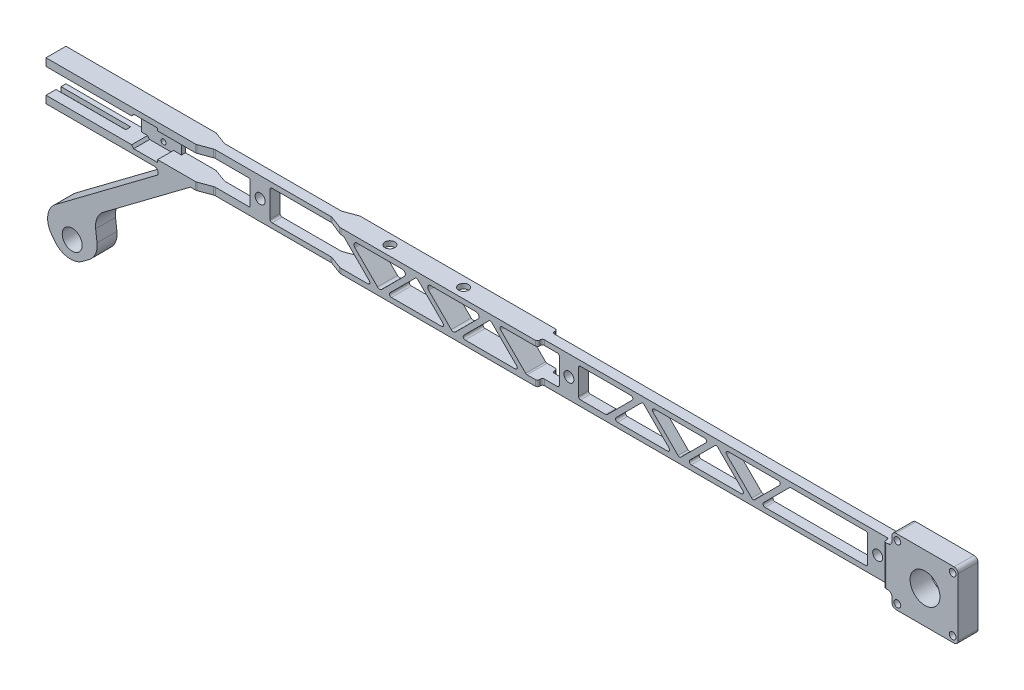
from build123d import *

# Parameters (mm, degrees)
BOSS_EXTRUDE1_DEPTH             = 12.7
CUT_EXTRUDE1_DEPTH              = 12.7
LPATTERN1_COUNT                 = 7
LPATTERN1_PITCH                 = 46.99
CUT_EXTRUDE2_DEPTH              = 12.7
LPATTERN2_COUNT                 = 8
LPATTERN2_PITCH                 = 46.99
CUT_EXTRUDE13_DEPTH             = 12.7
LPATTERN5_COUNT                 = 2
LPATTERN5_PITCH                 = 46.99
CUT_EXTRUDE10_DEPTH             = 12.7
LPATTERN3_COUNT                 = 2
LPATTERN3_PITCH                 = 46.99
SKETCH19_W                      = 3.175
SKETCH19_H                      = 22.225
CUT_EXTRUDE4_DEPTH              = 44.45
SKETCH18_W                      = 50.8
SKETCH18_H                      = 15.875
CUT_EXTRUDE3_DEPTH              = 573.205120564
CUT_EXTRUDE5_DEPTH              = 10.16
SKETCH21_W                      = 50.8
SKETCH21_H                      = 15.875
CUT_EXTRUDE6_DEPTH              = 573.154380915
F_1_8_0_125_DIAMETER_HOLE1_D    = 3.175
CUT_EXTRUDE17_DEPTH             = 12.7
CUT_EXTRUDE12_DEPTH             = 12.7
BOSS_EXTRUDE3_DEPTH             = 12.7
BOSS_EXTRUDE4_DEPTH             = 12.7
CUT_EXTRUDE7_DEPTH              = 12.7
SKETCH30_R                      = 6.35
BOSS_EXTRUDE5_DEPTH             = 12.7
CUT_EXTRUDE8_DEPTH              = 18.796
FILLET1_R                       = 12.7
F_1_4_0_25_DIAMETER_HOLE2_D     = 6.35
F_1_4_0_25_DIAMETER_HOLE3_D     = 6.35
F_1_4_0_25_DIAMETER_HOLE3_DEPTH = 3.175
F_1_4_0_25_DIAMETER_HOLE3_TIP   = 1.907732465
F_1_4_0_25_DIAMETER_HOLE1_D     = 6.35
SKETCH32_R                      = 3.175
BOSS_EXTRUDE6_DEPTH             = 12.7
SKETCH33_R                      = 9.525
SKETCH33_R_2                    = 2.159
CUT_EXTRUDE9_DEPTH              = 12.7
FILLET2_R                       = 2.54
CUT_EXTRUDE16_DEPTH             = 12.7
CUT_EXTRUDE15_REACH             = 592.724
CUT_EXTRUDE18_REACH             = 588.812


with BuildPart() as part:
    # Sketch1 → Boss-Extrude1 (new body)
    with BuildSketch(Plane.XY):
        with BuildLine():
            Line((2.54, 0), (568.96, 0))
            ThreePointArc((568.96, 0), (570.756051224, 0.743948776), (571.5, 2.54))
            Line((571.5, 2.54), (571.5, 22.86))
            ThreePointArc((571.5, 22.86), (570.756051224, 24.656051224), (568.96, 25.4))
            Line((568.96, 25.4), (2.54, 25.4))
            Line((2.54, 25.4), (0, 25.4))
            Line((0, 25.4), (0, 22.86))
            Line((0, 22.86), (0, 2.54))
            Line((0, 2.54), (0, 0))
            Line((0, 0), (2.54, 0))
        make_face()
    extrude(amount=BOSS_EXTRUDE1_DEPTH)

    # Sketch2 → Cut-Extrude1 (cut)
    with BuildSketch(Plane.XY):
        with BuildLine():
            Line((173.246051224, 3.175), (205.213948776, 3.175))
            ThreePointArc((205.213948776, 3.175), (206.387275782, 3.958992041), (206.111974388, 5.343025612))
            Line((206.111974388, 5.343025612), (190.128025612, 21.326974388))
            ThreePointArc((190.128025612, 21.326974388), (189.23, 21.698948776), (188.331974388, 21.326974388))
            Line((188.331974388, 21.326974388), (172.348025612, 5.343025612))
            ThreePointArc((172.348025612, 5.343025612), (172.072724218, 3.958992041), (173.246051224, 3.175))
        make_face()
    cut_extrude1 = extrude(amount=CUT_EXTRUDE1_DEPTH, mode=Mode.SUBTRACT)

    # LPattern1: Cut-Extrude1 ×7, 3 skipped
    with Locations(*[(i * LPATTERN1_PITCH, 0, 0) for i in range(1, LPATTERN1_COUNT) if i not in (1, 2, 3)]):
        add(cut_extrude1, mode=Mode.SUBTRACT)

    # Sketch3 → Cut-Extrude2 (cut)
    with BuildSketch(Plane.XY):
        with BuildLine():
            Line((149.751051224, 22.225), (181.718948776, 22.225))
            ThreePointArc((181.718948776, 22.225), (182.892275782, 21.441007959), (182.616974388, 20.056974388))
            Line((182.616974388, 20.056974388), (166.633025612, 4.073025612))
            ThreePointArc((166.633025612, 4.073025612), (165.735, 3.701051224), (164.836974388, 4.073025612))
            Line((164.836974388, 4.073025612), (148.853025612, 20.056974388))
            ThreePointArc((148.853025612, 20.056974388), (148.577724218, 21.441007959), (149.751051224, 22.225))
        make_face()
    cut_extrude2 = extrude(amount=CUT_EXTRUDE2_DEPTH, mode=Mode.SUBTRACT)

    # LPattern2: Cut-Extrude2 ×8, 2 skipped
    with Locations(*[(i * LPATTERN2_PITCH, 0, 0) for i in range(1, LPATTERN2_COUNT) if i not in (1, 2)]):
        add(cut_extrude2, mode=Mode.SUBTRACT)

    # Sketch37 → Cut-Extrude13 (cut)
    with BuildSketch(Plane.XY.offset(12.7)):
        with BuildLine():
            Line((198.274076836, 22.225), (227.175923164, 22.225))
            ThreePointArc((227.175923164, 22.225), (228.935913673, 21.049011939), (228.522961582, 18.972961582))
            Line((228.522961582, 18.972961582), (214.072038418, 4.522038418))
            ThreePointArc((214.072038418, 4.522038418), (212.725, 3.964076836), (211.377961582, 4.522038418))
            Line((211.377961582, 4.522038418), (196.927038418, 18.972961582))
            ThreePointArc((196.927038418, 18.972961582), (196.514086327, 21.049011939), (198.274076836, 22.225))
        make_face()
    cut_extrude13 = extrude(amount=-CUT_EXTRUDE13_DEPTH, mode=Mode.SUBTRACT)

    # LPattern5: Cut-Extrude13 ×2
    with Locations(*[(i * LPATTERN5_PITCH, 0, 0) for i in range(1, LPATTERN5_COUNT)]):
        add(cut_extrude13, mode=Mode.SUBTRACT)

    # Sketch34 → Cut-Extrude10 (cut)
    with BuildSketch(Plane.XY.offset(12.7)):
        with BuildLine():
            Line((220.236051224, 3.175), (252.203948776, 3.175))
            ThreePointArc((252.203948776, 3.175), (253.377275782, 3.958992041), (253.101974388, 5.343025612))
            Line((253.101974388, 5.343025612), (237.118025612, 21.326974388))
            ThreePointArc((237.118025612, 21.326974388), (236.22, 21.698948776), (235.321974388, 21.326974388))
            Line((235.321974388, 21.326974388), (219.338025612, 5.343025612))
            ThreePointArc((219.338025612, 5.343025612), (219.062724218, 3.958992041), (220.236051224, 3.175))
        make_face()
    cut_extrude10 = extrude(amount=-CUT_EXTRUDE10_DEPTH, mode=Mode.SUBTRACT)

    # LPattern3: Cut-Extrude10 ×2
    with Locations(*[(i * LPATTERN3_PITCH, 0, 0) for i in range(1, LPATTERN3_COUNT)]):
        add(cut_extrude10, mode=Mode.SUBTRACT)

    # Sketch19 → Cut-Extrude4 (cut)
    with BuildSketch(Plane.ZY):
        with Locations((4.7625, 12.7)):
            Rectangle(SKETCH19_W, SKETCH19_H)
    extrude(amount=-CUT_EXTRUDE4_DEPTH, mode=Mode.SUBTRACT)

    # Sketch18 → Cut-Extrude3 (cut, through all)
    with BuildSketch(Plane.XY.offset(12.7)):
        with Locations((25.4, 12.6365)):
            Rectangle(SKETCH18_W, SKETCH18_H)
    extrude(amount=-CUT_EXTRUDE3_DEPTH, mode=Mode.SUBTRACT)

    # Sketch20 → Cut-Extrude5 (cut)
    with BuildSketch(Plane.XY.offset(12.7)):
        Polygon((50.8, 20.574), (54.61, 20.574), (55.88, 22.1615), (71.12, 22.1615), (71.12, 20.574), (127, 20.574), (127, 4.699), (71.12, 4.699), (71.12, 3.1115), (55.88, 3.1115), (54.61, 4.699), (50.8, 4.699), align=None)
    extrude(amount=-CUT_EXTRUDE5_DEPTH, mode=Mode.SUBTRACT)

    # Sketch21 → Cut-Extrude6 (cut, through all)
    with BuildSketch(Plane.XY.offset(2.54)):
        with Locations((101.6, 12.6365)):
            Rectangle(SKETCH21_W, SKETCH21_H)
    extrude(amount=-CUT_EXTRUDE6_DEPTH, mode=Mode.SUBTRACT)

    # 1/8 (0.125) Diameter Hole1 (through all)
    with Locations(Plane.XY.offset(2.54)):
        with Locations((64.77, 18.9865), (64.77, 6.2865)):
            Hole(F_1_8_0_125_DIAMETER_HOLE1_D / 2)

    # Sketch46 → Cut-Extrude17 (cut)
    with BuildSketch(Plane.XY.offset(12.7)):
        with BuildLine():
            Line((173.246051224, 3.175), (140.97, 3.175))
            ThreePointArc((140.97, 3.175), (140.071974388, 3.546974388), (139.7, 4.445))
            Line((139.7, 4.445), (139.7, 20.955))
            ThreePointArc((139.7, 20.955), (140.071974388, 21.853025612), (140.97, 22.225))
            Line((140.97, 22.225), (181.718948776, 22.225))
            Line((181.718948776, 22.225), (189.23, 21.698948776))
            Line((189.23, 21.698948776), (173.246051224, 3.175))
        make_face()
    extrude(amount=-CUT_EXTRUDE17_DEPTH, mode=Mode.SUBTRACT)

    # Sketch36 → Cut-Extrude12 (cut)
    with BuildSketch(Plane.XY.offset(12.7)):
        with BuildLine():
            Line((306.705, 3.701051224), (322.834, 3.701051224))
            ThreePointArc((322.834, 3.701051224), (323.732025612, 4.073025612), (324.104, 4.971051224))
            Line((324.104, 4.971051224), (324.104, 20.955))
            ThreePointArc((324.104, 20.955), (323.732025612, 21.853025612), (322.834, 22.225))
            Line((322.834, 22.225), (322.688948776, 22.225))
            Line((322.688948776, 22.225), (306.705, 3.701051224))
        make_face()
    cut_extrude12 = extrude(amount=-CUT_EXTRUDE12_DEPTH, mode=Mode.SUBTRACT)

    # Mirror1: Cut-Extrude12 across plane
    add(cut_extrude12.mirror(Plane(origin=(330.2, 0, 0), x_dir=(0, 0, 1), z_dir=(1, 0, 0))), mode=Mode.SUBTRACT)

    # Sketch8 → Boss-Extrude3 (add)
    with BuildSketch(Plane.XY):
        Polygon((92.075, 0), (-9.525, -76.2), (-15.24, -68.58), (76.2, 0), align=None)
    extrude(amount=BOSS_EXTRUDE3_DEPTH)

    # Sketch13 → Boss-Extrude4 (add)
    with BuildSketch(Plane.XY):
        with BuildLine():
            Line((69.85, 0), (76.2, 0))
            Line((76.2, 0), (71.12, -3.81))
            ThreePointArc((71.12, -3.81), (71.419048922, -1.593650359), (69.85, 0))
        make_face()
    extrude(amount=BOSS_EXTRUDE4_DEPTH)

    # Sketch29 → Cut-Extrude7 (cut)
    with BuildSketch(Plane.XY.offset(12.7)):
        Polygon((-9.525, -76.2), (1.651, -67.818), (-0.254, -65.278), (-11.43, -73.66), align=None)
    extrude(amount=-CUT_EXTRUDE7_DEPTH, mode=Mode.SUBTRACT)

    # Sketch30 → Boss-Extrude5 (add)
    with BuildSketch(Plane(origin=(0, 0, 0), x_dir=(-1, 0, 0), z_dir=(0, 0, -1))):
        Polygon((-1.651, -67.818), (-13.081, -83.058), (-33.401, -67.818), (-30.769818102, -45.978886423), align=None)
        with Locations((-16.6878, -66.7004)):
            Circle(SKETCH30_R, mode=Mode.SUBTRACT)
    extrude(amount=-BOSS_EXTRUDE5_DEPTH)

    # Sketch31 → Cut-Extrude8 (cut)
    with BuildSketch(Plane(origin=(0, 0, 0), x_dir=(-1, 0, 0), z_dir=(0, 0, -1))):
        Polygon((0.254, -65.278), (4.064, -60.198), (15.24, -68.58), (11.43, -73.66), align=None)
    extrude(amount=-CUT_EXTRUDE8_DEPTH, mode=Mode.SUBTRACT)

    # Fillet1
    fillet1_edges = [part.edges().sort_by_distance(p)[0] for p in [
        (30.769818102, -45.978886423, 6.35),
        (13.081, -83.058, 6.35),
        (33.401, -67.818, 6.35),
        (-4.064, -60.198, 6.35),
    ]]
    fillet(fillet1_edges, radius=FILLET1_R)

    # 1/4 (0.25) Diameter Hole2 (through all)
    with Locations(Plane.XY.offset(12.7)):
        with Locations((133.35, 12.7), (330.2, 12.7), (527.05, 12.7)):
            Hole(F_1_4_0_25_DIAMETER_HOLE2_D / 2)

    # 1/4 (0.25) Diameter Hole3
    with Locations(Plane(origin=(0, 25.4, 0), x_dir=(1, 0, 0), z_dir=(0, 1, 0))):
        with Locations((212.888423164, -6.35), (259.878423164, -6.35)):
            Hole(F_1_4_0_25_DIAMETER_HOLE3_D / 2, depth=F_1_4_0_25_DIAMETER_HOLE3_DEPTH)
            with Locations((0, 0, -(F_1_4_0_25_DIAMETER_HOLE3_DEPTH + F_1_4_0_25_DIAMETER_HOLE3_TIP / 2))):  # 118° drill point
                Cone(0, F_1_4_0_25_DIAMETER_HOLE3_D / 2, F_1_4_0_25_DIAMETER_HOLE3_TIP, mode=Mode.SUBTRACT)

    # 1/4 (0.25) Diameter Hole1 (through all)
    with Locations(Plane.XY.offset(12.7)):
        with Locations((560.3875, 12.7)):
            Hole(F_1_4_0_25_DIAMETER_HOLE1_D / 2)

    # Sketch32 → Boss-Extrude6 (add)
    with BuildSketch(Plane(origin=(0, 0, 0), x_dir=(-1, 0, 0), z_dir=(0, 0, -1))):
        Polygon((-581.4695, 12.7), (-581.4695, 33.782), (-539.3055, 33.782), (-539.3055, 25.4), (-539.3055, 0), (-539.3055, -8.382), (-581.4695, -8.382), align=None)
        with Locations(Location((-560.3875, 12.7, 0), (0, 0, 180))):
            Circle(SKETCH32_R, mode=Mode.SUBTRACT)
    extrude(amount=-BOSS_EXTRUDE6_DEPTH)

    # Sketch33 → Cut-Extrude9 (cut)
    with BuildSketch(Plane.XY.offset(12.7)):
        with Locations((560.3875, 12.7)):
            Circle(SKETCH33_R)
        with Locations((578.005108392, 30.086668164)):
            Circle(SKETCH33_R_2)
        with Locations((578.005108392, -4.686668164)):
            Circle(SKETCH33_R_2)
        with Locations((542.769891608, -4.686668164)):
            Circle(SKETCH33_R_2)
        with Locations((542.769891608, 30.086668164)):
            Circle(SKETCH33_R_2)
    extrude(amount=-CUT_EXTRUDE9_DEPTH, mode=Mode.SUBTRACT)

    # Fillet2
    fillet2_edges = [part.edges().sort_by_distance(p)[0] for p in [
        (539.3055, 25.4, 6.35),
        (539.3055, 33.782, 6.35),
        (581.4695, -8.382, 6.35),
        (581.4695, 33.782, 6.35),
        (539.3055, 0, 6.35),
        (539.3055, -8.382, 6.35),
    ]]
    fillet(fillet2_edges, radius=FILLET2_R)

    # Sketch45 → Cut-Extrude16 (cut)
    with BuildSketch(Plane.XY.offset(12.7)):
        with BuildLine():
            Line((487.153948776, 3.175), (519.43, 3.175))
            ThreePointArc((519.43, 3.175), (520.328025612, 3.546974388), (520.7, 4.445))
            Line((520.7, 4.445), (520.7, 20.955))
            ThreePointArc((520.7, 20.955), (520.328025612, 21.853025612), (519.43, 22.225))
            Line((519.43, 22.225), (510.648948776, 22.225))
            Line((510.648948776, 22.225), (471.696051224, 22.225))
            ThreePointArc((471.696051224, 22.225), (471.210043265, 22.128327006), (470.798025612, 21.853025612))
            Line((470.798025612, 21.853025612), (470.271974388, 21.326974388))
            Line((470.271974388, 21.326974388), (487.153948776, 3.175))
        make_face()
    extrude(amount=-CUT_EXTRUDE16_DEPTH, mode=Mode.SUBTRACT)

    # Cut-Extrude15: up to this face of the body (flat: up to its plane)
    cut_extrude15_end = Plane(part.part.faces().sort_by_distance((34.925, 0, 6.35))[0])
    # Sketch40 → Cut-Extrude15 (cut, up to the picked face)
    with BuildSketch(Plane(origin=(0, 25.4, 0), x_dir=(1, 0, 0), z_dir=(0, 1, 0)), mode=Mode.PRIVATE) as cut_extrude15_sk1:
        with BuildLine():
            Line((187.96, 0), (95.25, 0))
            ThreePointArc((95.25, 0), (95.695915492, -0.039448186), (96.127980151, -0.156567422))
            Line((96.127980151, -0.156567422), (103.897019849, -3.018432578))
            ThreePointArc((103.897019849, -3.018432578), (104.329084508, -3.135551814), (104.775, -3.175))
            Line((104.775, -3.175), (178.435, -3.175))
            ThreePointArc((178.435, -3.175), (178.880915492, -3.135551814), (179.312980151, -3.018432578))
            Line((179.312980151, -3.018432578), (187.082019849, -0.156567422))
            ThreePointArc((187.082019849, -0.156567422), (187.514084508, -0.039448186), (187.96, 0))
        make_face()
    cut_extrude15_tool1 = split(extrude(cut_extrude15_sk1.sketch, amount=-CUT_EXTRUDE15_REACH, mode=Mode.PRIVATE), bisect_by=cut_extrude15_end, keep=Keep.BOTH, mode=Mode.PRIVATE)
    cut_extrude15 = cut_extrude15_tool1.solids().sort_by(Axis((141.605, 25.4, 1.532389), (0, -1, 0)))[0]
    add(cut_extrude15, mode=Mode.SUBTRACT)

    # Cut-Extrude18: up to this face of the body (flat: up to its plane)
    cut_extrude18_end = Plane(part.part.faces().sort_by_distance((273.854746055, 25.4, 6.546070011))[0])
    # Sketch47 → Cut-Extrude18 (cut, up to the picked face)
    with BuildSketch(Plane.XZ, mode=Mode.PRIVATE) as cut_extrude18_sk1:
        with BuildLine():
            Line((534.2255, 11.43), (534.2255, 10.795))
            ThreePointArc((534.2255, 10.795), (533.853525612, 9.896974388), (532.9555, 9.525))
            Line((532.9555, 9.525), (314.5155, 9.525))
            ThreePointArc((314.5155, 9.525), (313.617474388, 9.896974388), (313.2455, 10.795))
            Line((313.2455, 10.795), (313.2455, 11.43))
            ThreePointArc((313.2455, 11.43), (312.873525612, 12.328025612), (311.9755, 12.7))
            Line((311.9755, 12.7), (534.2255, 12.7))
            Line((534.2255, 12.7), (535.4955, 12.7))
            ThreePointArc((535.4955, 12.7), (534.597474388, 12.328025612), (534.2255, 11.43))
        make_face()
    cut_extrude18_tool1 = split(extrude(cut_extrude18_sk1.sketch, amount=-CUT_EXTRUDE18_REACH, mode=Mode.PRIVATE), bisect_by=cut_extrude18_end, keep=Keep.BOTH, mode=Mode.PRIVATE)
    cut_extrude18 = cut_extrude18_tool1.solids().sort_by(Axis((423.7355, 0, 11.115073), (0, 1, 0)))[0]
    add(cut_extrude18, mode=Mode.SUBTRACT)

    # Mirror2: Cut-Extrude15, Cut-Extrude18 across plane
    add(cut_extrude15.mirror(Plane.XY.offset(6.35)), mode=Mode.SUBTRACT)
    add(cut_extrude18.mirror(Plane.XY.offset(6.35)), mode=Mode.SUBTRACT)


solid = part.part
